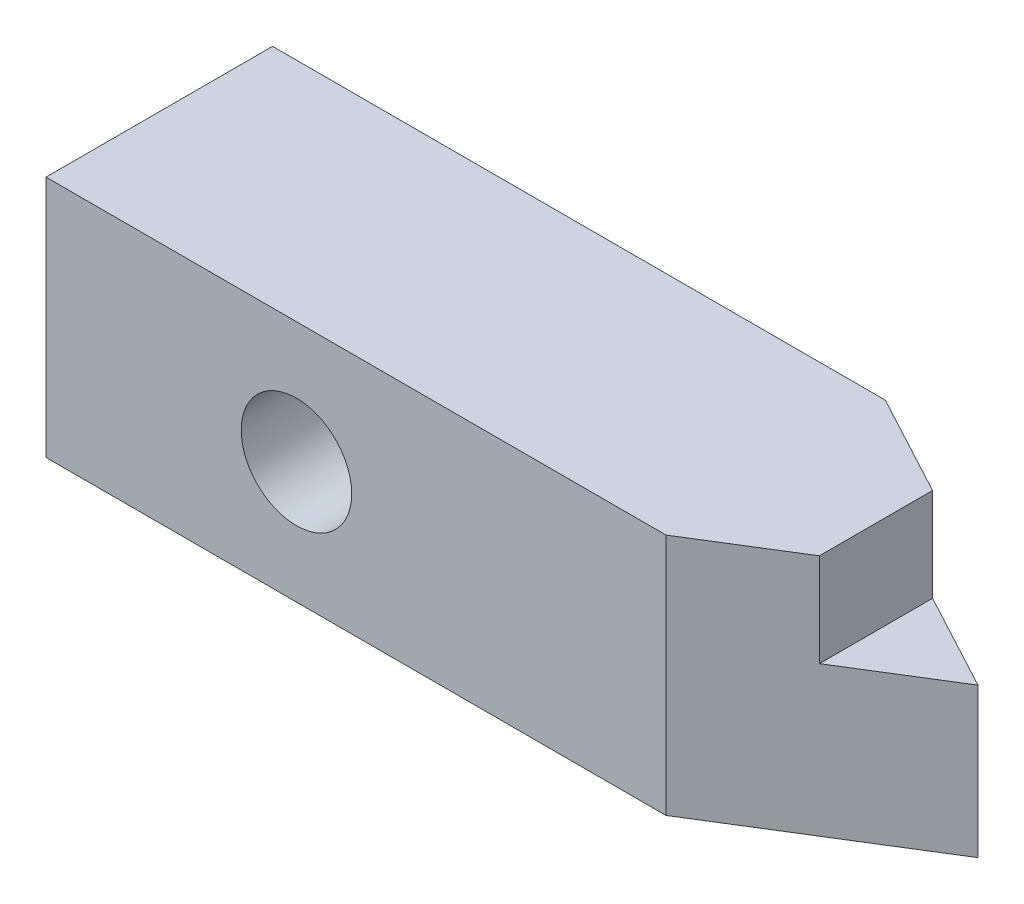
from build123d import *

# Parameters (mm, degrees)
EXTRUDE_1_DEPTH     = 26
SKETCH_3_R          = 5.915746271
SKETCH_3_W          = 24.366628961
SKETCH_3_H          = 13.595872682
CUT_EXTRUDE_2_DEPTH = 46


with BuildPart() as part:
    # 스케치2 → 보스-돌출1 (new body)
    with BuildSketch(Plane(origin=(0, 0, 0), x_dir=(1, 0, 0), z_dir=(0, 1, 0))):
        Polygon((-30.145598194, 0), (-30.145598194, 24.253001272), (35.467738861, 24.253001272), (56.854401806, 12.789785553), (36.233634312, 0), align=None)
    extrude(amount=EXTRUDE_1_DEPTH)

    # 스케치3 → 컷-돌출2 (cut)
    with BuildSketch(Plane.XY):
        with Locations((-3.33144194, 13)):
            Circle(SKETCH_3_R)
        with Locations((58.556264228, 22.797936341)):
            Rectangle(SKETCH_3_W, SKETCH_3_H)
    extrude(amount=-CUT_EXTRUDE_2_DEPTH, mode=Mode.SUBTRACT)


solid = part.part
